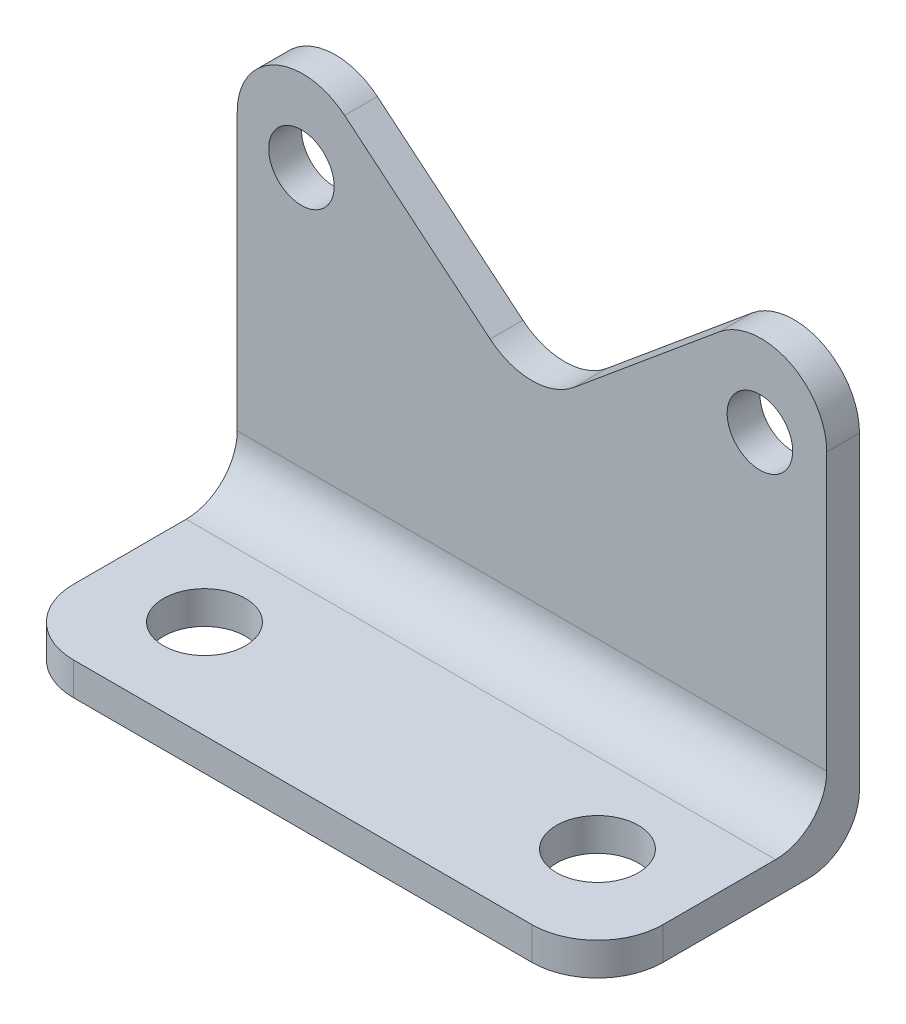
from build123d import *

# Parameters (mm, degrees)
SKETCH2_W               = 57.15
SKETCH2_H               = 41.275
BOSS_EXTRUDE1_DEPTH     = 3.175
SKETCH7_W               = 25.4
SKETCH7_H               = 3.175
BOSS_EXTRUDE2_DEPTH     = 57.15
CUT_EXTRUDE3_DEPTH      = 66.857337528
CUT_EXTRUDE3_DEPTH_BACK = 57.15
FILLET1_R               = 4.953
FILLET2_R               = 6.35
FILLET3_R               = 6.35
SKETCH13_R              = 3.175
CUT_EXTRUDE5_DEPTH      = 57.15
SKETCH14_R              = 3.9751
CUT_EXTRUDE6_DEPTH      = 57.15
CUT_EXTRUDE8_DEPTH      = 42.669985076


with BuildPart() as part:
    # Sketch2 → Boss-Extrude1 (new body)
    with BuildSketch(Plane.XY):
        Rectangle(SKETCH2_W, SKETCH2_H)
    extrude(amount=BOSS_EXTRUDE1_DEPTH)

    # Sketch7 → Boss-Extrude2 (add)
    with BuildSketch(Plane(origin=(28.575, 0, 0), x_dir=(0, 0, -1), z_dir=(1, 0, 0))):
        with Locations((-12.7, -19.05)):
            Rectangle(SKETCH7_W, SKETCH7_H)
    extrude(amount=-BOSS_EXTRUDE2_DEPTH)

    # Sketch8 → Cut-Extrude3 (cut, two sides: drawn at the far end of the back side and taken through both)
    with BuildSketch(Plane(origin=(28.575, 0, 0), x_dir=(0, 0, -1), z_dir=(1, 0, 0)).offset(-CUT_EXTRUDE3_DEPTH_BACK)):
        with BuildLine():
            Line((0, 86.439447679), (0, -15.6845))
            ThreePointArc((0, -15.6845), (-1.450700113, -19.186799887), (-4.953, -20.6375))
            Line((-4.953, -20.6375), (-107.076947679, -20.6375))
            Line((-107.076947679, -20.6375), (37.348124172, -165.062571851))
            Line((37.348124172, -165.062571851), (144.425071851, -57.985624172))
            Line((144.425071851, -57.985624172), (0, 86.439447679))
        make_face()
    extrude(amount=CUT_EXTRUDE3_DEPTH + CUT_EXTRUDE3_DEPTH_BACK, mode=Mode.SUBTRACT)

    # Fillet1
    fillet1_edges = [part.edges().sort_by_distance(p)[0] for p in [
        (0, -17.4625, 3.175),
    ]]
    fillet(fillet1_edges, radius=FILLET1_R)

    # Fillet2
    fillet2_edges = [part.edges().sort_by_distance(p)[0] for p in [
        (28.575, -19.05, 25.4),
    ]]
    fillet(fillet2_edges, radius=FILLET2_R)

    # Fillet3
    fillet3_edges = [part.edges().sort_by_distance(p)[0] for p in [
        (-28.575, -19.05, 25.4),
    ]]
    fillet(fillet3_edges, radius=FILLET3_R)

    # Sketch13 → Cut-Extrude5 (cut)
    with BuildSketch(Plane.XY.offset(3.175)):
        with Locations((-22.350267212, 12.7)):
            Circle(SKETCH13_R)
        with Locations((22.099732788, 12.7)):
            Circle(SKETCH13_R)
    extrude(amount=-CUT_EXTRUDE5_DEPTH, mode=Mode.SUBTRACT)

    # Sketch14 → Cut-Extrude6 (cut)
    with BuildSketch(Plane(origin=(0, -17.4625, 0), x_dir=(1, 0, 0), z_dir=(0, 1, 0))):
        with Locations(Location((-19.05, -15.875, 0), (0, 0, 270))):
            Circle(SKETCH14_R)
        with Locations(Location((19.05, -15.875, 0), (0, 0, 270))):
            Circle(SKETCH14_R)
    extrude(amount=-CUT_EXTRUDE6_DEPTH, mode=Mode.SUBTRACT)

    # Sketch15 → Cut-Extrude8 (cut, through all)
    with BuildSketch(Plane.XY.offset(3.175)):
        with BuildLine():
            ThreePointArc((-22.225, 20.6375), (-20.067470257, 20.259732866), (-18.166647231, 19.171378869))
            Line((-18.166647231, 19.171378869), (-4.058352769, 7.447821131))
            ThreePointArc((-4.058352769, 7.447821131), (0, 5.9817), (4.058352769, 7.447821131))
            Line((4.058352769, 7.447821131), (18.166647231, 19.171378869))
            ThreePointArc((18.166647231, 19.171378869), (20.067470257, 20.259732866), (22.225, 20.6375))
            Line((22.225, 20.6375), (-22.225, 20.6375))
        make_face()
        with BuildLine():
            ThreePointArc((-28.575, 14.2875), (-26.715128061, 18.777628061), (-22.225, 20.6375))
            Line((-22.225, 20.6375), (-28.575, 20.6375))
            Line((-28.575, 20.6375), (-28.575, 14.2875))
        make_face()
        with BuildLine():
            Line((28.575, 20.6375), (22.225, 20.6375))
            ThreePointArc((22.225, 20.6375), (26.715128061, 18.777628061), (28.575, 14.2875))
            Line((28.575, 14.2875), (28.575, 20.6375))
        make_face()
    extrude(amount=-CUT_EXTRUDE8_DEPTH, mode=Mode.SUBTRACT)


solid = part.part
